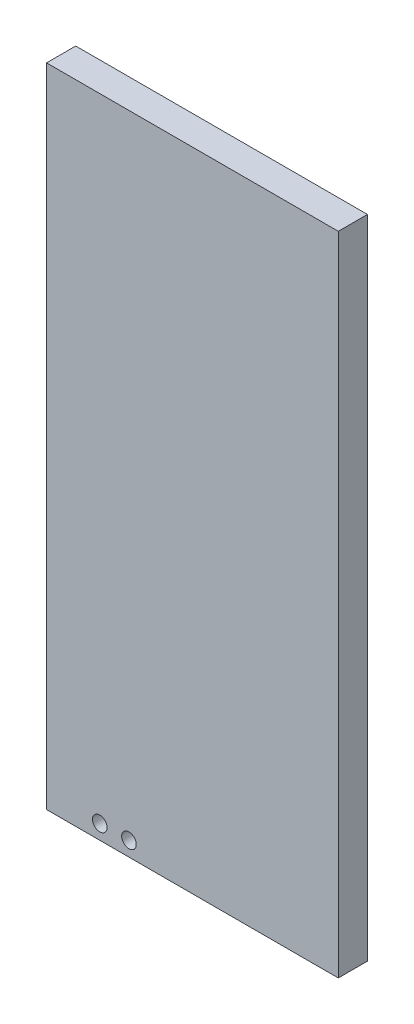
from build123d import *

# Parameters (mm, degrees)
ESQUISSE3_W             = 60
ESQUISSE3_H             = 133
BOSS_EXTRU_2_DEPTH      = 6
ESQUISSE4_R             = 1.5
ENL_V_MAT_EXTRU_1_DEPTH = 74.200068306
ESQUISSE5_R             = 2.995
ENL_V_MAT_EXTRU_2_DEPTH = 3


with BuildPart() as part:
    # Esquisse3 → Boss.-Extru.2 (new body)
    with BuildSketch(Plane.XY):
        Rectangle(ESQUISSE3_W, ESQUISSE3_H)
    extrude(amount=BOSS_EXTRU_2_DEPTH)

    # Esquisse4 → Enlèv. mat.-Extru.1 (cut, through all)
    with BuildSketch(Plane(origin=(0, 0, 0), x_dir=(-1, 0, 0), z_dir=(0, 0, -1))):
        with Locations((13.05, -63.5)):
            Circle(ESQUISSE4_R)
        with Locations((19.05, -63.5)):
            Circle(ESQUISSE4_R)
    extrude(amount=-ENL_V_MAT_EXTRU_1_DEPTH, mode=Mode.SUBTRACT)

    # Esquisse5 → Enlèv. mat.-Extru.2 (cut)
    with BuildSketch(Plane(origin=(0, 0, 0), x_dir=(-1, 0, 0), z_dir=(0, 0, -1))):
        with Locations((13.05, -63.5)):
            Circle(ESQUISSE5_R)
        with Locations((19.05, -63.5)):
            Circle(ESQUISSE5_R)
    extrude(amount=-ENL_V_MAT_EXTRU_2_DEPTH, mode=Mode.SUBTRACT)


solid = part.part
